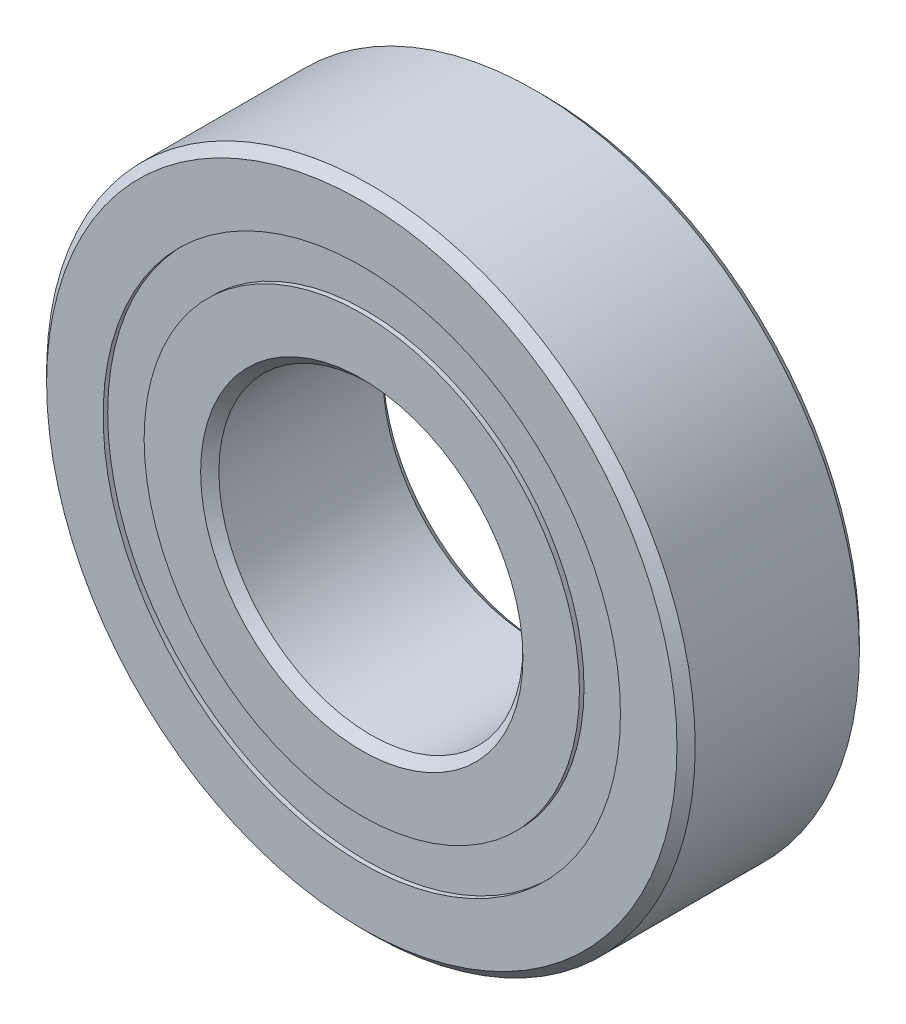
from build123d import *

# Parameters (mm, degrees)
CIRPATTERN1_COUNT = 12


with BuildPart() as part:
    # Sketch6 → Revolve1 (revolve)
    with BuildSketch(Plane(origin=(0, 0, 0), x_dir=(0, 0, -1), z_dir=(1, 0, 0))):
        with BuildLine():
            Line((-4.5, 15.55), (-4.499999999999999, 12.760989010989016))
            Line((-4.499999999999999, 12.760989010989016), (-2, 12.760989010989016))
            ThreePointArc((-2, 12.760989010989016), (1.4e-16, 13.9910039670515), (2, 12.760989010989016))
            Line((2, 12.760989010989016), (4.499999999999999, 12.760989010989016))
            Line((4.499999999999999, 12.760989010989016), (4.5, 15.549999999999994))
            Line((4.5, 15.549999999999994), (4.049999999999996, 16))
            Line((4.049999999999996, 16), (-4.049999999999996, 16.000000000000007))
            Line((-4.049999999999996, 16.000000000000007), (-4.5, 15.55))
        make_face()
        with BuildLine():
            Line((-4.499999999999999, 7.950000000000013), (-4.499999999999999, 10.73901098901099))
            Line((-4.499999999999999, 10.73901098901099), (-2.0000000000000004, 10.73901098901099))
            ThreePointArc((-2.0000000000000004, 10.73901098901099), (-3.6e-16, 9.508996032948508), (2, 10.73901098901099))
            Line((2, 10.73901098901099), (4.499999999999999, 10.73901098901099))
            Line((4.499999999999999, 10.73901098901099), (4.499999999999999, 7.950000000000013))
            Line((4.499999999999999, 7.950000000000013), (4.049999999999999, 7.500000000000007))
            Line((4.049999999999999, 7.500000000000007), (-4.049999999999999, 7.500000000000007))
            Line((-4.049999999999999, 7.500000000000007), (-4.499999999999999, 7.950000000000013))
        make_face()
    revolve(axis=Axis((0, 0, 4.499999999999999), (0, 0, -1)))



with BuildPart() as body_2:
    # Sketch4 → Revolve2 (revolve)
    with BuildSketch(Plane(origin=(0, 0, 0), x_dir=(0, 0, -1), z_dir=(1, 0, 0))):
        with BuildLine():
            Line((-2.2410039670514963, 11.750000000000004), (2.2410039670514963, 11.750000000000004))
            ThreePointArc((2.2410039670514963, 11.750000000000004), (1.4e-16, 13.9910039670515), (-2.2410039670514963, 11.750000000000004))
        make_face()
    revolve(axis=Axis((0, 11.750000000000004, 2.2410039670514963), (0, 0, -1)))


with BuildPart() as cirpattern1_1:
    # CirPattern1: pattern copy
    add(body_2.part.rotate(Axis((0, 0, -4.499999999999999), (0, 0, 1)), 1 * 360 / CIRPATTERN1_COUNT))


with BuildPart() as cirpattern1_2:
    # CirPattern1: pattern copy
    add(body_2.part.rotate(Axis((0, 0, -4.499999999999999), (0, 0, 1)), 2 * 360 / CIRPATTERN1_COUNT))


with BuildPart() as cirpattern1_3:
    # CirPattern1: pattern copy
    add(body_2.part.rotate(Axis((0, 0, -4.499999999999999), (0, 0, 1)), 3 * 360 / CIRPATTERN1_COUNT))


with BuildPart() as cirpattern1_4:
    # CirPattern1: pattern copy
    add(body_2.part.rotate(Axis((0, 0, -4.499999999999999), (0, 0, 1)), 4 * 360 / CIRPATTERN1_COUNT))


with BuildPart() as cirpattern1_5:
    # CirPattern1: pattern copy
    add(body_2.part.rotate(Axis((0, 0, -4.499999999999999), (0, 0, 1)), 5 * 360 / CIRPATTERN1_COUNT))


with BuildPart() as cirpattern1_6:
    # CirPattern1: pattern copy
    add(body_2.part.rotate(Axis((0, 0, -4.499999999999999), (0, 0, 1)), 6 * 360 / CIRPATTERN1_COUNT))


with BuildPart() as cirpattern1_7:
    # CirPattern1: pattern copy
    add(body_2.part.rotate(Axis((0, 0, -4.499999999999999), (0, 0, 1)), 7 * 360 / CIRPATTERN1_COUNT))


with BuildPart() as cirpattern1_8:
    # CirPattern1: pattern copy
    add(body_2.part.rotate(Axis((0, 0, -4.499999999999999), (0, 0, 1)), 8 * 360 / CIRPATTERN1_COUNT))


with BuildPart() as cirpattern1_9:
    # CirPattern1: pattern copy
    add(body_2.part.rotate(Axis((0, 0, -4.499999999999999), (0, 0, 1)), 9 * 360 / CIRPATTERN1_COUNT))


with BuildPart() as cirpattern1_10:
    # CirPattern1: pattern copy
    add(body_2.part.rotate(Axis((0, 0, -4.499999999999999), (0, 0, 1)), 10 * 360 / CIRPATTERN1_COUNT))


with BuildPart() as cirpattern1_11:
    # CirPattern1: pattern copy
    add(body_2.part.rotate(Axis((0, 0, -4.499999999999999), (0, 0, 1)), 11 * 360 / CIRPATTERN1_COUNT))


with BuildPart() as part_1:
    add(part.part)

    add(body_2.part)  # Revolve3 merges body 2

    add(cirpattern1_1.part)  # Revolve3 merges CirPattern1_1

    add(cirpattern1_2.part)  # Revolve3 merges CirPattern1_2

    add(cirpattern1_3.part)  # Revolve3 merges CirPattern1_3

    add(cirpattern1_4.part)  # Revolve3 merges CirPattern1_4

    add(cirpattern1_5.part)  # Revolve3 merges CirPattern1_5

    add(cirpattern1_6.part)  # Revolve3 merges CirPattern1_6

    add(cirpattern1_7.part)  # Revolve3 merges CirPattern1_7

    add(cirpattern1_8.part)  # Revolve3 merges CirPattern1_8

    add(cirpattern1_9.part)  # Revolve3 merges CirPattern1_9

    add(cirpattern1_10.part)  # Revolve3 merges CirPattern1_10

    add(cirpattern1_11.part)  # Revolve3 merges CirPattern1_11
    # Sketch5 → Revolve3 (revolve)
    with BuildSketch(Plane(origin=(0, 0, 0), x_dir=(0, 0, -1), z_dir=(1, 0, 0))):
        Polygon((-4.275000000000004, 12.760989010989016), (-2.2410039670514963, 12.760989010989016), (-2.2410039670514954, 10.73901098901099), (-4.275000000000004, 10.73901098901099), align=None)
        Polygon((4.275000000000004, 12.760989010989016), (2.2410039670514963, 12.760989010989016), (2.241003967051497, 10.73901098901099), (4.275000000000004, 10.73901098901099), align=None)
    revolve(axis=Axis((0, 0, 4.499999999999999), (0, 0, -1)))


solid = part_1.part
